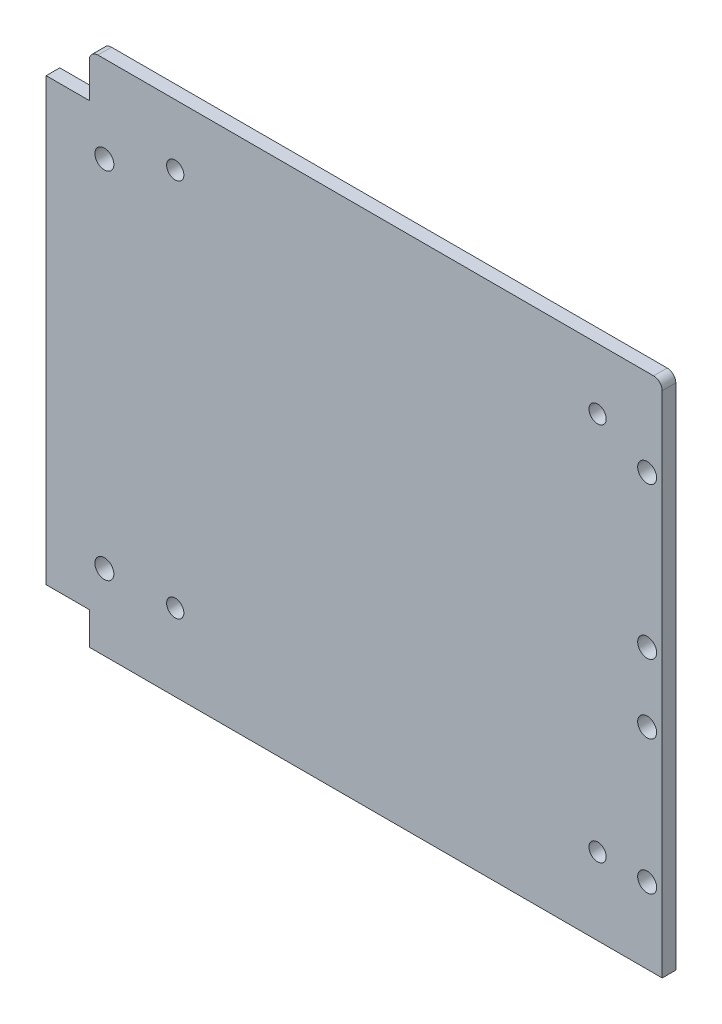
from build123d import *

# Parameters (mm, degrees)
BOSS_EXTRUDE1_DEPTH   = 1.5748
SKETCH10_W            = 66.47
SKETCH10_H            = 4.17478322
BOSS_EXTRUDE3_DEPTH   = 1.575
SKETCH11_W            = 66.47
SKETCH11_H            = 0.5
CUT_EXTRUDE2_DEPTH    = 140.38485176
M2_CLEARANCE_HOLE1_D  = 2.2
F_2_0MM_DOWEL_HOLE1_D = 2
SKETCH12_W            = 5
SKETCH12_H            = 51.15
BOSS_EXTRUDE4_DEPTH   = 1.575


with BuildPart() as part:
    # BPR2 PCB Outline → Boss-Extrude1 (new body)
    with BuildSketch(Plane.XY):
        with BuildLine():
            Line((56.570984325, 67.317563979), (121.040984325, 67.317563979))
            ThreePointArc((121.040984325, 67.317563979), (121.748091106, 67.02467076), (122.040984325, 66.317563979))
            Line((122.040984325, 66.317563979), (122.040984325, 7.817563979))
            ThreePointArc((122.040984325, 7.817563979), (121.748091106, 7.110457198), (121.040984325, 6.817563979))
            Line((121.040984325, 6.817563979), (103.596984325, 6.817563979))
            Line((103.596984325, 6.817563979), (83.596984325, 6.817563979))
            Line((83.596984325, 6.817563979), (55.570984325, 6.817563979))
            Line((55.570984325, 6.817563979), (55.570984325, 66.317563979))
            ThreePointArc((55.570984325, 66.317563979), (55.863877543, 67.02467076), (56.570984325, 67.317563979))
        make_face()
    extrude(amount=-BOSS_EXTRUDE1_DEPTH)

    # Sketch10 → Boss-Extrude3 (add)
    with BuildSketch(Plane.XY):
        with Locations((88.805984325, 8.904955589)):
            Rectangle(SKETCH10_W, SKETCH10_H)
    extrude(amount=-BOSS_EXTRUDE3_DEPTH)

    # Sketch11 → Cut-Extrude2 (cut, through all)
    with BuildSketch(Plane.XY):
        with Locations((88.805984325, 7.067563979)):
            Rectangle(SKETCH11_W, SKETCH11_H)
    extrude(amount=-CUT_EXTRUDE2_DEPTH, mode=Mode.SUBTRACT)

    # M2 Clearance Hole1 (through all)
    with Locations(Plane(origin=(39.260906477, 104.204612391, -6.5748), x_dir=(1, 0, 0), z_dir=(0, 0, -1))):
        with Locations((81.030077848, 88.112048412), (81.030077848, 72.537048412), (81.030077848, 64.537048412), (81.030077848, 46.962048412), (18.060077848, 46.962048412), (18.060077848, 88.112048412)):
            Hole(M2_CLEARANCE_HOLE1_D / 2)

    # Ø2.0mm Dowel Hole1 (through all)
    with Locations(Plane(origin=(39.260906477, 104.204612391, -4.6498), x_dir=(1, 0, 0), z_dir=(0, 0, -1))):
        with Locations((26.280077848, 87.962048412), (26.280077848, 43.962048412), (75.280077848, 43.962048412), (75.280077848, 87.962048412)):
            Hole(F_2_0MM_DOWEL_HOLE1_D / 2)

    # Sketch12 → Boss-Extrude4 (add, through all)
    with BuildSketch(Plane.XY):
        with Locations((53.070984325, 36.667563979)):
            Rectangle(SKETCH12_W, SKETCH12_H)
    extrude(amount=-BOSS_EXTRUDE4_DEPTH)


solid = part.part
